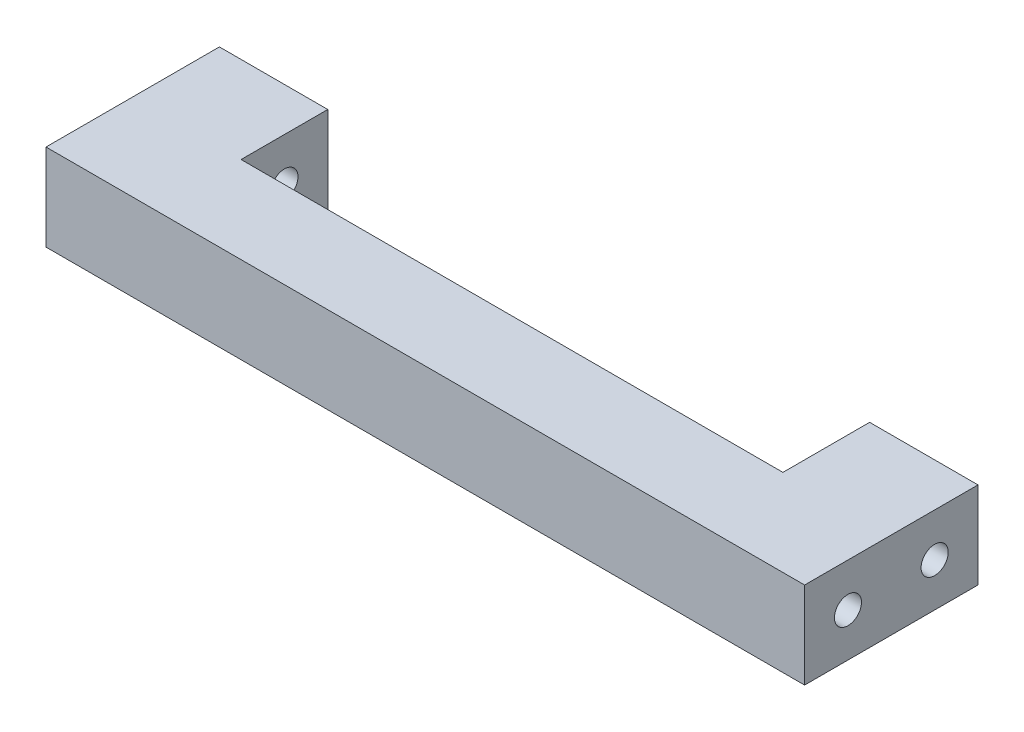
from build123d import *

# Parameters (mm, degrees)
SKETCH_1_W          = 70
SKETCH_1_H          = 16
EXTRUDE_1_DEPTH     = 8
SKETCH_2_W          = 50
SKETCH_2_H          = 8
CUT_EXTRUDE_1_DEPTH = 37.783148315
SKETCH_3_R          = 1.25
CUT_EXTRUDE_2_DEPTH = 20


with BuildPart() as part:
    # 草图1 → 凸台-拉伸1 (new body)
    with BuildSketch(Plane(origin=(0, 0, 0), x_dir=(1, 0, 0), z_dir=(0, 1, 0))):
        Rectangle(SKETCH_1_W, SKETCH_1_H)
    extrude(amount=EXTRUDE_1_DEPTH)

    # 草图2 → 切除-拉伸1 (cut, through all)
    with BuildSketch(Plane(origin=(0, 8, 0), x_dir=(1, 0, 0), z_dir=(0, 1, 0))):
        with Locations((0, 4)):
            Rectangle(SKETCH_2_W, SKETCH_2_H)
    extrude(amount=-CUT_EXTRUDE_1_DEPTH, mode=Mode.SUBTRACT)

    # 草图3 → 切除-拉伸2 (cut)
    with BuildSketch(Plane(origin=(35, 0, 0), x_dir=(0, 0, -1), z_dir=(1, 0, 0))):
        with Locations((-4, 4)):
            Circle(SKETCH_3_R)
        with Locations((4, 4)):
            Circle(SKETCH_3_R)
    cut_extrude_2 = extrude(amount=-CUT_EXTRUDE_2_DEPTH, mode=Mode.SUBTRACT)

    # 镜向1: 切除-拉伸2 across plane
    add(cut_extrude_2.mirror(Plane(origin=(0, 0, 0), x_dir=(0, 0, 1), z_dir=(1, 0, 0))), mode=Mode.SUBTRACT)


solid = part.part
